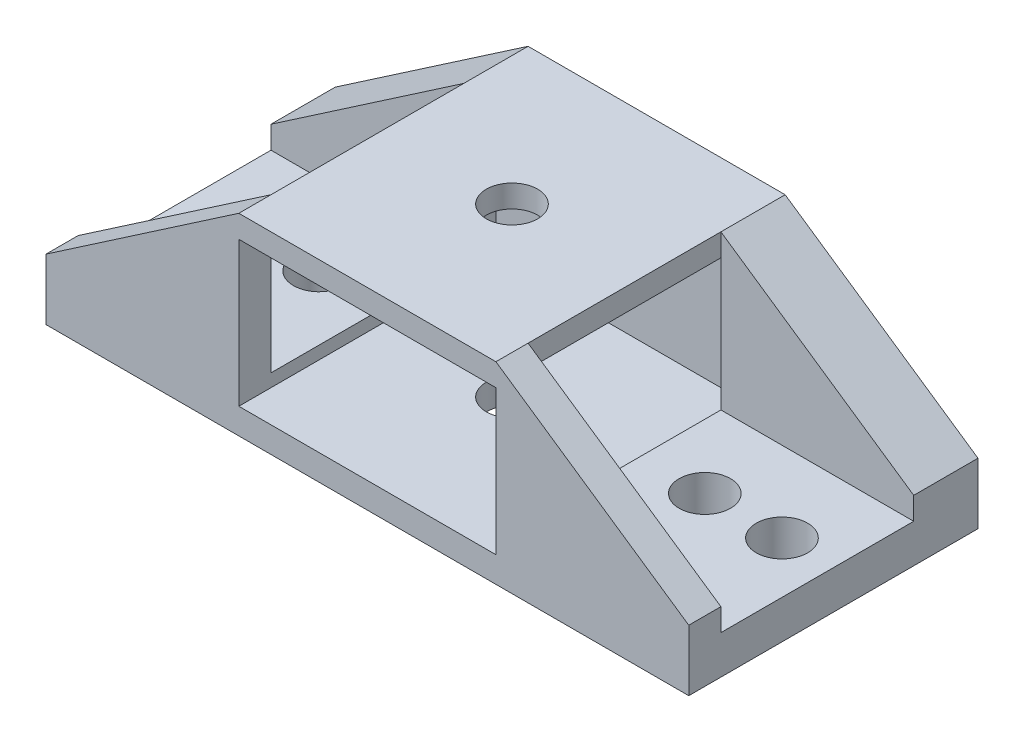
from build123d import *

# Parameters (mm, degrees)
SKETCH1_W           = 20
SKETCH1_H           = 11.25
BOSS_EXTRUDE1_DEPTH = 3
SKETCH1_3_W         = 20
SKETCH1_3_H         = 11.25
BOSS_EXTRUDE2_DEPTH = 15
SKETCH2_W           = 20
SKETCH2_H           = 11.25
CUT_EXTRUDE1_DEPTH  = 20
BOSS_EXTRUDE3_REACH = 58.127
SKETCH3_W           = 15
SKETCH3_H           = 5
SKETCH3_H_2         = 2.5
CUT_EXTRUDE2_REACH  = 58.844
SKETCH5_R           = 2
CUT_EXTRUDE3_DEPTH  = 57.844085005


with BuildPart() as part:
    # Sketch1 → Boss-Extrude1 (new body)
    with BuildSketch(Plane(origin=(0, 0, 0), x_dir=(1, 0, 0), z_dir=(0, 1, 0))):
        with BuildLine():
            Line((15, 11.25), (15, 22.5))
            Line((15, 22.5), (0, 22.5))
            Line((0, 22.5), (0, 11.25))
            Line((0, 11.25), (2, 11.25))
            ThreePointArc((2, 11.25), (4, 13.25), (6, 11.25))
            Line((6, 11.25), (8, 11.25))
            ThreePointArc((8, 11.25), (10, 13.25), (12, 11.25))
            Line((12, 11.25), (15, 11.25))
        make_face()
        with BuildLine():
            Line((0, 0), (15, 0))
            Line((15, 0), (15, 11.25))
            Line((15, 11.25), (12, 11.25))
            ThreePointArc((12, 11.25), (10, 9.25), (8, 11.25))
            Line((8, 11.25), (6, 11.25))
            ThreePointArc((6, 11.25), (4, 9.25), (2, 11.25))
            Line((2, 11.25), (0, 11.25))
            Line((0, 11.25), (0, 0))
        make_face()
        with Locations((25, 5.625)):
            Rectangle(SKETCH1_W, SKETCH1_H)
        with Locations((25, 16.875)):
            Rectangle(SKETCH1_W, SKETCH1_H)
        with BuildLine():
            Line((50, 11.25), (48, 11.25))
            ThreePointArc((48, 11.25), (46, 9.25), (44, 11.25))
            Line((44, 11.25), (42, 11.25))
            ThreePointArc((42, 11.25), (40, 9.25), (38, 11.25))
            Line((38, 11.25), (35, 11.25))
            Line((35, 11.25), (35, 0))
            Line((35, 0), (50, 0))
            Line((50, 0), (50, 11.25))
        make_face()
        with BuildLine():
            ThreePointArc((44, 11.25), (46, 13.25), (48, 11.25))
            Line((48, 11.25), (50, 11.25))
            Line((50, 11.25), (50, 22.5))
            Line((50, 22.5), (35, 22.5))
            Line((35, 22.5), (35, 11.25))
            Line((35, 11.25), (38, 11.25))
            ThreePointArc((38, 11.25), (40, 13.25), (42, 11.25))
            Line((42, 11.25), (44, 11.25))
        make_face()
    extrude(amount=BOSS_EXTRUDE1_DEPTH)

    # Sketch1<3> → Boss-Extrude2 (add)
    with BuildSketch(Plane(origin=(0, 0, 0), x_dir=(1, 0, 0), z_dir=(0, 1, 0))):
        with Locations((25, 5.625)):
            Rectangle(SKETCH1_3_W, SKETCH1_3_H)
        with Locations((25, 16.875)):
            Rectangle(SKETCH1_3_W, SKETCH1_3_H)
    extrude(amount=BOSS_EXTRUDE2_DEPTH)

    # Sketch2 → Cut-Extrude1 (cut)
    with BuildSketch(Plane.XY):
        with Locations((25, 7.625)):
            Rectangle(SKETCH2_W, SKETCH2_H)
    extrude(amount=-CUT_EXTRUDE1_DEPTH, mode=Mode.SUBTRACT)

    # Boss-Extrude3: up to this face of the body (flat: up to its plane)
    boss_extrude3_end = Plane(part.part.faces().sort_by_distance((25, 15, -11.25))[0])
    # Sketch3 → Boss-Extrude3 (add, up to the picked face)
    with BuildSketch(Plane(origin=(0, 3, 0), x_dir=(1, 0, 0), z_dir=(0, 1, 0)), mode=Mode.PRIVATE) as boss_extrude3_sk1:
        with Locations((42.5, 20)):
            Rectangle(SKETCH3_W, SKETCH3_H)
    boss_extrude3_tool1 = split(extrude(boss_extrude3_sk1.sketch, amount=BOSS_EXTRUDE3_REACH, mode=Mode.PRIVATE), bisect_by=boss_extrude3_end, keep=Keep.BOTH, mode=Mode.PRIVATE)
    # Sketch3 → Boss-Extrude3 (add, up to the picked face)
    with BuildSketch(Plane(origin=(0, 3, 0), x_dir=(1, 0, 0), z_dir=(0, 1, 0)), mode=Mode.PRIVATE) as boss_extrude3_sk2:
        with Locations((7.5, 20)):
            Rectangle(SKETCH3_W, SKETCH3_H)
    boss_extrude3_tool2 = split(extrude(boss_extrude3_sk2.sketch, amount=BOSS_EXTRUDE3_REACH, mode=Mode.PRIVATE), bisect_by=boss_extrude3_end, keep=Keep.BOTH, mode=Mode.PRIVATE)
    # Sketch3 → Boss-Extrude3 (add, up to the picked face)
    with BuildSketch(Plane(origin=(0, 3, 0), x_dir=(1, 0, 0), z_dir=(0, 1, 0)), mode=Mode.PRIVATE) as boss_extrude3_sk3:
        with Locations((7.5, 1.25)):
            Rectangle(SKETCH3_W, SKETCH3_H_2)
    boss_extrude3_tool3 = split(extrude(boss_extrude3_sk3.sketch, amount=BOSS_EXTRUDE3_REACH, mode=Mode.PRIVATE), bisect_by=boss_extrude3_end, keep=Keep.BOTH, mode=Mode.PRIVATE)
    # Sketch3 → Boss-Extrude3 (add, up to the picked face)
    with BuildSketch(Plane(origin=(0, 3, 0), x_dir=(1, 0, 0), z_dir=(0, 1, 0)), mode=Mode.PRIVATE) as boss_extrude3_sk4:
        with Locations((42.5, 1.25)):
            Rectangle(SKETCH3_W, SKETCH3_H_2)
    boss_extrude3_tool4 = split(extrude(boss_extrude3_sk4.sketch, amount=BOSS_EXTRUDE3_REACH, mode=Mode.PRIVATE), bisect_by=boss_extrude3_end, keep=Keep.BOTH, mode=Mode.PRIVATE)
    add(boss_extrude3_tool1.solids().sort_by(Axis((42.5, 3, -20), (0, 1, 0)))[0])
    add(boss_extrude3_tool2.solids().sort_by(Axis((7.5, 3, -20), (0, 1, 0)))[0])
    add(boss_extrude3_tool3.solids().sort_by(Axis((7.5, 3, -1.25), (0, 1, 0)))[0])
    add(boss_extrude3_tool4.solids().sort_by(Axis((42.5, 3, -1.25), (0, 1, 0)))[0])

    # Cut-Extrude2: up to this face of the body (flat: up to its plane)
    cut_extrude2_end = Plane(part.part.faces().sort_by_distance((25, 7.5, -22.5))[0])
    # Sketch4 → Cut-Extrude2 (cut, up to the picked face)
    with BuildSketch(Plane.XY, mode=Mode.PRIVATE) as cut_extrude2_sk1:
        Polygon((0, 4.75), (15, 15), (0, 15), align=None)
    cut_extrude2_tool1 = split(extrude(cut_extrude2_sk1.sketch, amount=-CUT_EXTRUDE2_REACH, mode=Mode.PRIVATE), bisect_by=cut_extrude2_end, keep=Keep.BOTH, mode=Mode.PRIVATE)
    # Sketch4 → Cut-Extrude2 (cut, up to the picked face)
    with BuildSketch(Plane.XY, mode=Mode.PRIVATE) as cut_extrude2_sk2:
        Polygon((50, 15), (35, 15), (50, 4.75), align=None)
    cut_extrude2_tool2 = split(extrude(cut_extrude2_sk2.sketch, amount=-CUT_EXTRUDE2_REACH, mode=Mode.PRIVATE), bisect_by=cut_extrude2_end, keep=Keep.BOTH, mode=Mode.PRIVATE)
    add(cut_extrude2_tool1.solids().sort_by(Axis((5, 11.583333, 0), (0, 0, -1)))[0], mode=Mode.SUBTRACT)
    add(cut_extrude2_tool2.solids().sort_by(Axis((45, 11.583333, 0), (0, 0, -1)))[0], mode=Mode.SUBTRACT)

    # Sketch5 → Cut-Extrude3 (cut, through all)
    with BuildSketch(Plane(origin=(0, 15, 0), x_dir=(1, 0, 0), z_dir=(0, 1, 0))):
        with Locations(Location((25, 11.25, 0), (0, 0, 270))):
            Circle(SKETCH5_R)
    extrude(amount=-CUT_EXTRUDE3_DEPTH, mode=Mode.SUBTRACT)


solid = part.part
